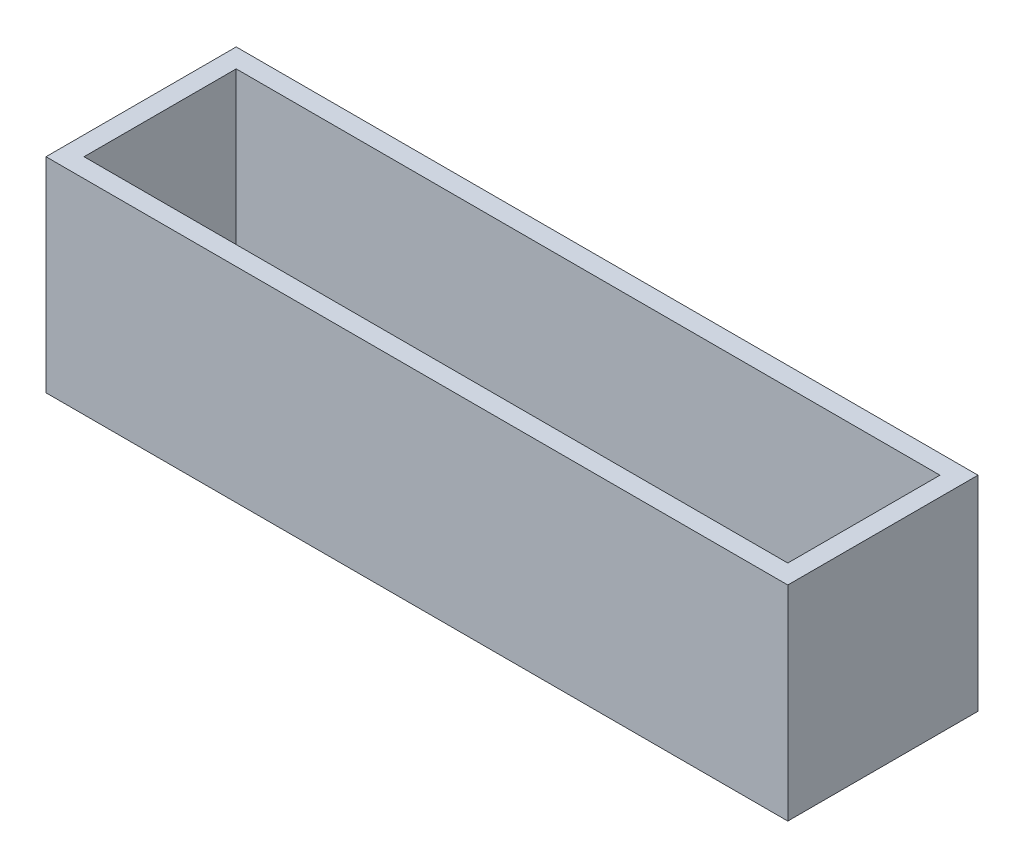
from build123d import *

# Parameters (mm, degrees)
SKETCH_1_W      = 78
SKETCH_1_H      = 20
EXTRUDE_1_DEPTH = 21.5
SHELL_1_T       = -2


with BuildPart() as part:
    # Эскиз1 → Бобышка-Вытянуть1 (new body)
    with BuildSketch(Plane(origin=(0, 0, 0), x_dir=(1, 0, 0), z_dir=(0, 1, 0))):
        Rectangle(SKETCH_1_W, SKETCH_1_H)
    extrude(amount=EXTRUDE_1_DEPTH)

    # Оболочка1
    shell_1_openings = [part.faces().sort_by_distance(p)[0] for p in [
        (0, 21.5, 0),
    ]]
    offset(amount=SHELL_1_T, openings=shell_1_openings, kind=Kind.INTERSECTION)


solid = part.part
